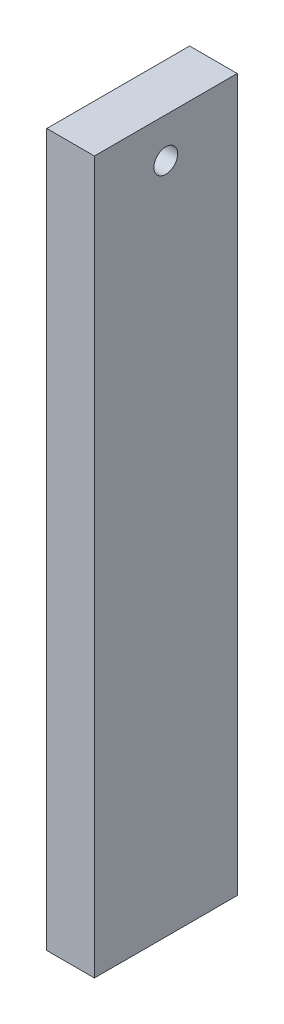
from build123d import *

# Parameters (mm, degrees)
SKETCH1_W               = 2
SKETCH1_H               = 6.898115708
BOSS_EXTRUDE1_DEPTH     = 4
SKETCH2_W               = 2
SKETCH2_H               = 4
BOSS_EXTRUDE2_DEPTH     = 23
SKETCH3_W               = 4
SKETCH3_H               = 29.895089618
SKETCH3_R               = 0.5
SKETCH3_W_2             = 1
BOSS_EXTRUDE4_DEPTH     = 2
CUT_EXTRUDE1_DEPTH      = 25.491073296
CUT_EXTRUDE1_DEPTH_BACK = 25.491073296
SKETCH4_R               = 0.5


with BuildPart() as part:
    # Sketch1 → Boss-Extrude1 (new body)
    with BuildSketch(Plane.XY):
        with Locations((0.466430338, -2.557371618)):
            Rectangle(SKETCH1_W, SKETCH1_H)
    extrude(amount=BOSS_EXTRUDE1_DEPTH)

    # Sketch2 → Boss-Extrude2 (add)
    with BuildSketch(Plane(origin=(0, 0.891686236, 0), x_dir=(1, 0, 0), z_dir=(0, 1, 0))):
        with Locations((0.466430338, -2)):
            Rectangle(SKETCH2_W, SKETCH2_H)
    extrude(amount=BOSS_EXTRUDE2_DEPTH)

    # Sketch3 → Boss-Extrude4 (add, through all)
    # profile 1 of 3: a face of its own
    with BuildSketch(Plane(origin=(1.466430338, 0, 0), x_dir=(0, 0, -1), z_dir=(1, 0, 0))):
        with Locations((-2, 8.944141427)):
            Rectangle(SKETCH3_W, SKETCH3_H)
        with Locations((-2, 22.225736667)):
            Circle(SKETCH3_R, mode=Mode.SUBTRACT)
    # profile 2 of 3: a face of its own
    with BuildSketch(Plane(origin=(1.466430338, 0, 0), x_dir=(0, 0, -1), z_dir=(1, 0, 0))):
        with Locations((-4.5, 8.944141427)):
            Rectangle(SKETCH3_W_2, SKETCH3_H)
    # profile 3 of 3: a face of its own
    with BuildSketch(Plane(origin=(1.466430338, 0, 0), x_dir=(0, 0, -1), z_dir=(1, 0, 0))):
        with Locations((0.5, 8.944141427)):
            Rectangle(SKETCH3_W_2, SKETCH3_H)
    extrude(amount=-BOSS_EXTRUDE4_DEPTH)

    # Sketch4 → Cut-Extrude1 (cut, two sides: drawn at the far end of the back side and taken through both)
    with BuildSketch(Plane(origin=(1.466430338, 0, 0), x_dir=(0, 0, -1), z_dir=(1, 0, 0)).offset(-CUT_EXTRUDE1_DEPTH_BACK)):
        with Locations(Location((-2, 22.225736667, 0), (0, 0, 90))):
            Circle(SKETCH4_R)
    extrude(amount=CUT_EXTRUDE1_DEPTH + CUT_EXTRUDE1_DEPTH_BACK, mode=Mode.SUBTRACT)


solid = part.part
